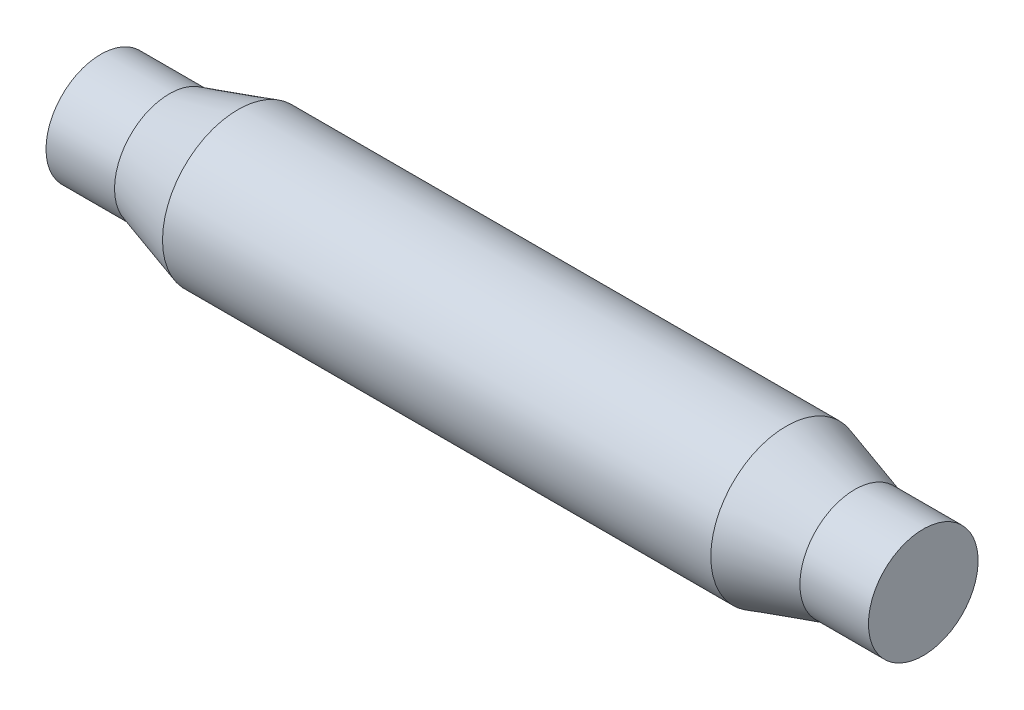
from build123d import *


with BuildPart() as part:
    # Esquisse2 → Révolution2 (revolve)
    with BuildSketch(Plane(origin=(0, 0, 0), x_dir=(1, 0, 0), z_dir=(0, 1, 0)), mode=Mode.PRIVATE) as r_volution2_sk:
        Polygon((-30, 0), (30, 0), (30, 4), (25, 4), (20, 5.5), (-20, 5.5), (-25, 4), (-30, 4), align=None)
    revolve(r_volution2_sk.sketch.rotate(Axis((-30, 0, 0), (1, 0, 0)), 180), axis=Axis((-30, 0, 0), (1, 0, 0)))


solid = part.part
